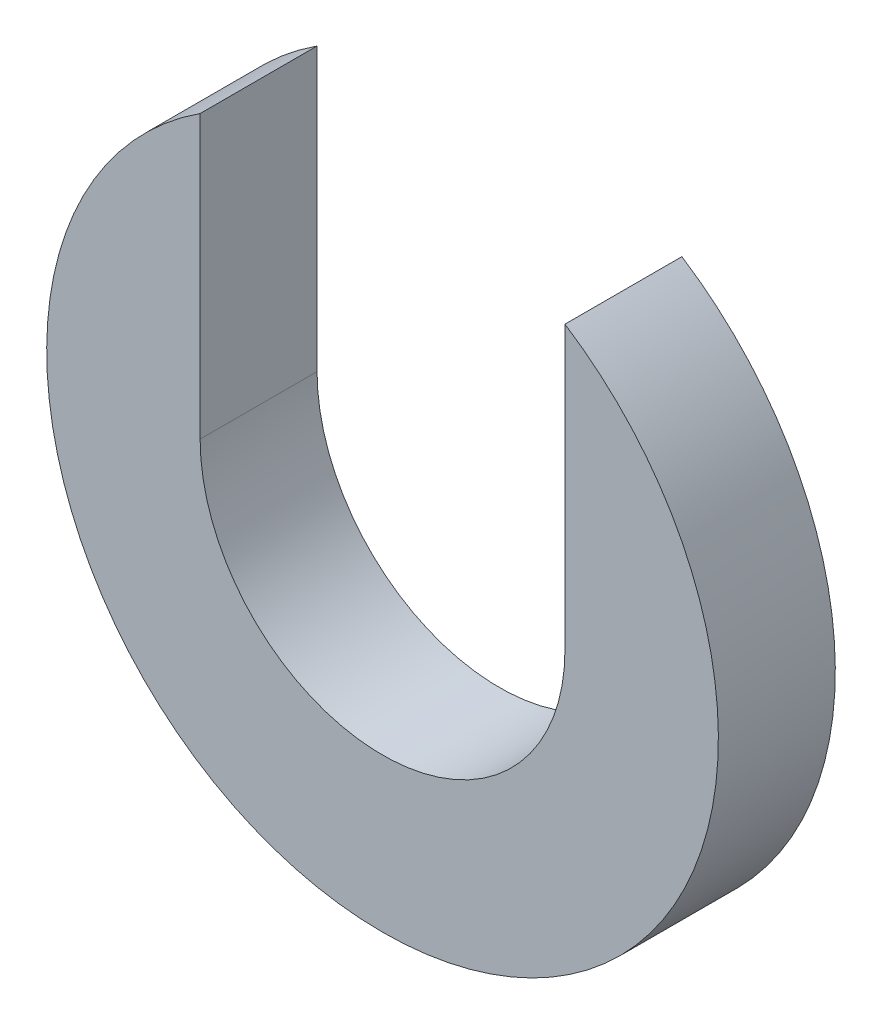
from build123d import *

# Parameters (mm, degrees)
BOSS_EXTRUDE1_DEPTH = 3.175


with BuildPart() as part:
    # Sketch1 → Boss-Extrude1 (new body)
    with BuildSketch(Plane.XY):
        with BuildLine():
            Line((-4.953, 7.656151576), (-4.953, 0))
            ThreePointArc((-4.953, 0), (0, -4.953), (4.953, 0))
            Line((4.953, 0), (4.953, 7.656151576))
            ThreePointArc((4.953, 7.656151576), (0, -9.1186), (-4.953, 7.656151576))
        make_face()
    extrude(amount=BOSS_EXTRUDE1_DEPTH)


solid = part.part
